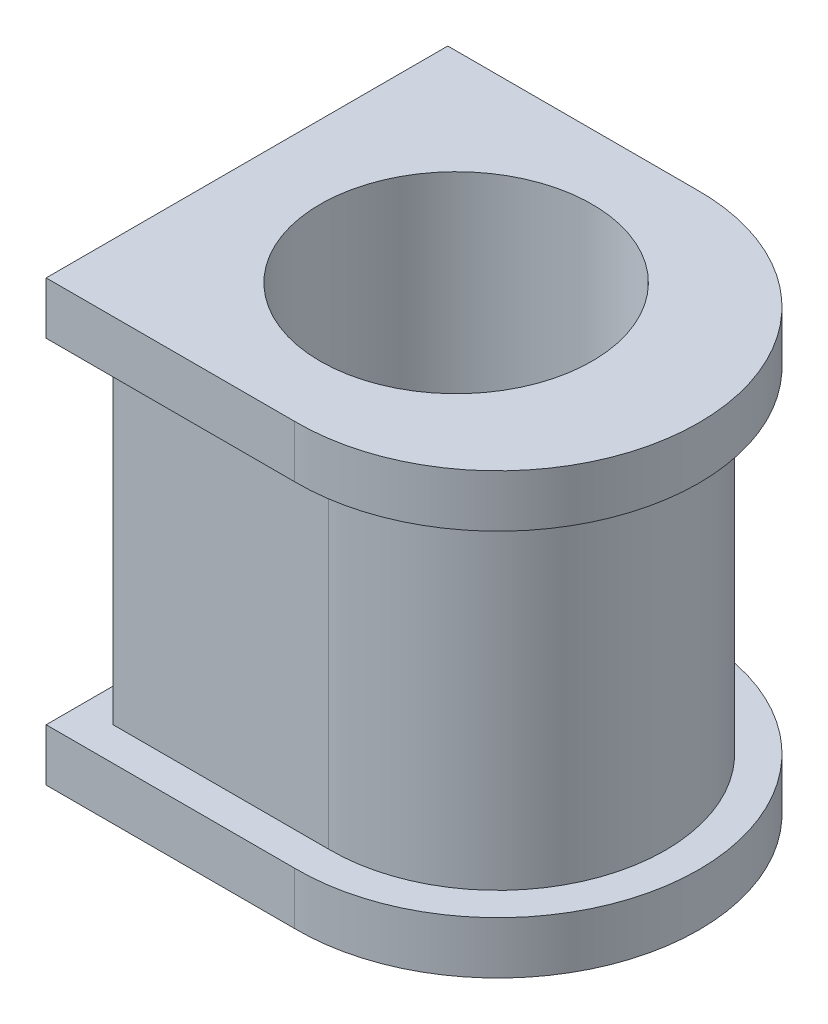
from build123d import *

# Parameters (mm, degrees)
SKETCH1_R           = 32.5
BOSS_EXTRUDE1_DEPTH = 80
SKETCH2_R           = 32.5
BOSS_EXTRUDE2_DEPTH = 12.5


with BuildPart() as part:
    # Sketch1 → Boss-Extrude1 (new body)
    with BuildSketch(Plane(origin=(0, 0, 0), x_dir=(1, 0, 0), z_dir=(0, 1, 0))):
        with BuildLine():
            Line((-26, 40), (25.450485774, 40))
            ThreePointArc((25.450485774, 40), (66.003774395, 0), (25.450485774, -40))
            Line((25.450485774, -40), (-26, -40))
            Line((-26, -40), (-26, 40))
        make_face()
        with Locations(Location((16, 0, 0), (0, 0, 270))):
            Circle(SKETCH1_R, mode=Mode.SUBTRACT)
    extrude(amount=BOSS_EXTRUDE1_DEPTH)

    # Sketch2 → Boss-Extrude2 (add)
    with BuildSketch(Plane(origin=(0, 80, 0), x_dir=(1, 0, 0), z_dir=(0, 1, 0))):
        with BuildLine():
            Line((-34, 48), (-34, -48))
            Line((-34, -48), (25.398039692, -48))
            ThreePointArc((25.398039692, -48), (74.003774395, 0), (25.398039692, 48))
            Line((25.398039692, 48), (-34, 48))
        make_face()
        with Locations(Location((16, 0, 0), (0, 0, 270))):
            Circle(SKETCH2_R, mode=Mode.SUBTRACT)
    boss_extrude2 = extrude(amount=BOSS_EXTRUDE2_DEPTH)

    # Mirror1: Boss-Extrude2 across plane
    add(boss_extrude2.mirror(Plane.ZX.offset(40)))


solid = part.part
